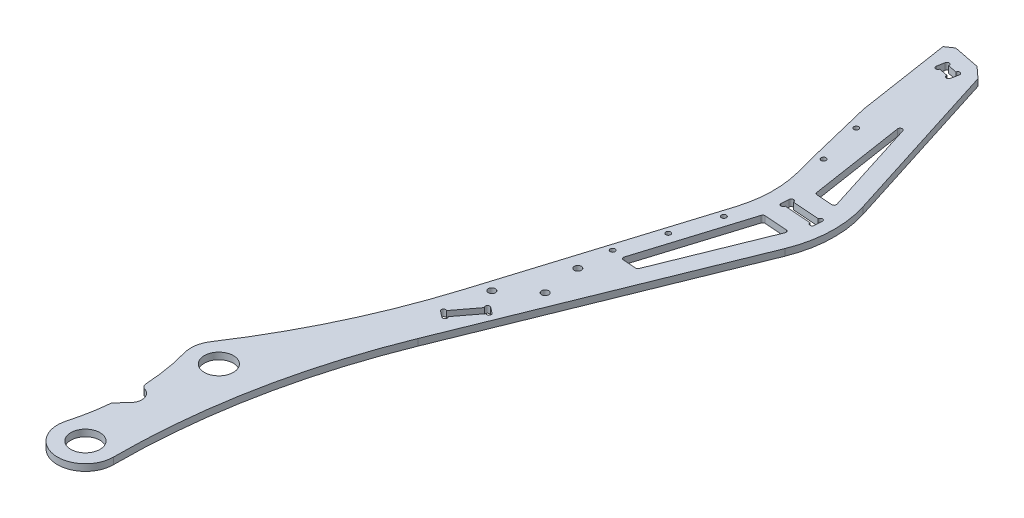
from build123d import *

# Parameters (mm, degrees)
SKETCH_3_R          = 12.55
SKETCH_3_R_2        = 6.55
EXTRUDE_1_DEPTH     = 3
CUT_EXTRUDE_3_DEPTH = 337.61902384
EXTRUDE_2_DEPTH     = 3
CHAMFER_1_SIZE      = 4
CHAMFER_1_SIZE2     = 3.120824035
CHAMFER_2_SIZE      = 4
CHAMFER_2_SIZE2     = 3.866160824
CHAMFER_3_SIZE      = 4
CHAMFER_3_SIZE2     = 23.911485469
SKETCH_8_R          = 1
CUT_EXTRUDE_4_DEPTH = 336.947679111
SKETCH_9_R          = 1.1
SKETCH_9_R_2        = 1.6
CUT_EXTRUDE_5_DEPTH = 336.947679111
FILLET_1_R          = 50
CUT_EXTRUDE_6_DEPTH = 335.374368924
FILLET_2_R          = 1
FILLET_3_R          = 1
EXTRUDE_3_DEPTH     = 3


with BuildPart() as part:
    # 草图3 → 凸台-拉伸1 (new body)
    # profile 1 of 4: a face of its own
    with BuildSketch(Plane(origin=(0, 0, 0), x_dir=(1, 0, 0), z_dir=(0, 1, 0))):
        with BuildLine():
            Line((121.265604443, 289.597455686), (128.868463655, 240.178870804))
            Line((128.868463655, 240.178870804), (141.647697325, 191.053787979))
            Line((141.647697325, 191.053787979), (108.429878461, 83.756455888))
            ThreePointArc((108.429878461, 83.756455888), (92.967297732, 44.045236663), (72.033938301, 6.925608458))
            ThreePointArc((72.033938301, 6.925608458), (86.116173784, 12.017728037), (95.05, 0))
            ThreePointArc((95.05, 0), (94.935972216, -1.687926254), (94.59596095, -3.34517992))
            ThreePointArc((94.59596095, -3.34517992), (96.273603044, 2.110037129), (98.259734457, 7.460659342))
            Line((98.259734457, 7.460659342), (171.571212245, 188.912934219))
            Line((171.571212245, 188.912934219), (140.881048659, 285.694335372))
            Line((140.881048659, 285.694335372), (121.265604443, 289.597455686))
        make_face()
    # profile 2 of 4: a face of its own
    with BuildSketch(Plane(origin=(0, 0, 0), x_dir=(1, 0, 0), z_dir=(0, 1, 0))):
        with Locations((82.5, 0)):
            Circle(SKETCH_3_R)
        with Locations(Location((82.5, 0, 0), (0, 0, 270))):
            Circle(SKETCH_3_R_2, mode=Mode.SUBTRACT)
    # profile 3 of 4: a face of its own
    with BuildSketch(Plane(origin=(0, 0, 0), x_dir=(1, 0, 0), z_dir=(0, 1, 0))):
        with BuildLine():
            ThreePointArc((94.59596095, -3.34517992), (82.5, -12.55), (70.40403905, -3.34517992))
            ThreePointArc((70.40403905, -3.34517992), (74.021880086, -30), (70.40403905, -56.65482008))
            ThreePointArc((70.40403905, -56.65482008), (82.5, -47.45), (94.59596095, -56.65482008))
            ThreePointArc((94.59596095, -56.65482008), (90.978119914, -30), (94.59596095, -3.34517992))
        make_face()
    # profile 4 of 4: a face of its own
    with BuildSketch(Plane(origin=(0, 0, 0), x_dir=(1, 0, 0), z_dir=(0, 1, 0))):
        with Locations((82.5, -60)):
            Circle(SKETCH_3_R)
        with Locations(Location((82.5, -60, 0), (0, 0, 270))):
            Circle(SKETCH_3_R_2, mode=Mode.SUBTRACT)
    extrude(amount=EXTRUDE_1_DEPTH)

    # 草图7 → 切除-拉伸3 (cut, through all)
    with BuildSketch(Plane(origin=(0, 3, 0), x_dir=(1, 0, 0), z_dir=(0, 1, 0))):
        with BuildLine():
            ThreePointArc((78.002512198, -34.493479197), (80.195428175, -33.349158141), (81.33105467, -31.151726999))
            ThreePointArc((81.33105467, -31.151726999), (81.29055467, -30.45576741), (81.33105467, -29.75980782))
            ThreePointArc((81.33105467, -29.75980782), (79.648864591, -27.101907795), (76.578597142, -26.418055622))
            ThreePointArc((76.578597142, -26.418055622), (74.734518785, -25.952185157), (73.857268025, -24.264556235))
            ThreePointArc((73.857268025, -24.264556235), (74.006073686, -31.777928612), (73.590239535, -39.281260509))
            Line((73.590239535, -39.281260509), (78.002512198, -34.493479197))
        make_face()
    extrude(amount=-CUT_EXTRUDE_3_DEPTH, mode=Mode.SUBTRACT)

    # 草图7<3> → 凸台-拉伸2 (add)
    with BuildSketch(Plane(origin=(0, 3, 0), x_dir=(1, 0, 0), z_dir=(0, 1, 0))):
        with BuildLine():
            ThreePointArc((91.066651947, -25.793033303), (90.979085958, -30.43955416), (91.10749612, -35.085125677))
            ThreePointArc((91.10749612, -35.085125677), (91.947297407, -34.239250868), (92.603316411, -33.24405769))
            ThreePointArc((92.603316411, -33.24405769), (93.116212163, -31.891634666), (93.29055467, -30.45576741))
            ThreePointArc((93.29055467, -30.45576741), (92.937299887, -28.427401453), (91.919131852, -26.637878821))
            ThreePointArc((91.919131852, -26.637878821), (91.514069696, -26.194086893), (91.066651947, -25.793033303))
        make_face()
        with BuildLine():
            ThreePointArc((92.603316411, -33.24405769), (91.947297407, -34.239250868), (91.10749612, -35.085125677))
            ThreePointArc((91.10749612, -35.085125677), (91.236559388, -37.184782804), (91.409760465, -39.281260509))
            ThreePointArc((91.409760465, -39.281260509), (91.568630527, -36.176084637), (92.603316411, -33.24405769))
        make_face()
        with BuildLine():
            ThreePointArc((91.142731975, -24.264556235), (91.101768, -25.028649229), (91.066651947, -25.793033303))
            ThreePointArc((91.066651947, -25.793033303), (91.514069696, -26.194086893), (91.919131852, -26.637878821))
            ThreePointArc((91.919131852, -26.637878821), (91.306680236, -25.524578384), (91.142731975, -24.264556235))
        make_face()
    extrude(amount=-EXTRUDE_2_DEPTH)

    # 倒角1
    chamfer_1_edges = [part.edges().sort_by_distance(p)[0] for p in [
        (121.265604443, 1.5, -289.597455686),
    ]]
    chamfer_1_side = [part.faces().sort_by_distance(p)[0] for p in [
        (131.073326551, 1.5, -287.645895529),
    ]]
    chamfer(chamfer_1_edges, length=CHAMFER_1_SIZE, length2=CHAMFER_1_SIZE2, reference=chamfer_1_side[0])

    # 倒角2
    chamfer_2_edges = [part.edges().sort_by_distance(p)[0] for p in [
        (140.881048659, 1.5, -285.694335372),
    ]]
    chamfer_2_side = [part.faces().sort_by_distance(p)[0] for p in [
        (156.226130452, 1.5, -237.303634796),
    ]]
    chamfer(chamfer_2_edges, length=CHAMFER_2_SIZE, length2=CHAMFER_2_SIZE2, reference=chamfer_2_side[0])

    # 倒角3
    chamfer_3_edges = [part.edges().sort_by_distance(p)[0] for p in [
        (128.868463655, 1.5, -240.178870804),
    ]]
    chamfer_3_side = [part.faces().sort_by_distance(p)[0] for p in [
        (125.304305907, 1.5, -263.34589617),
    ]]
    chamfer(chamfer_3_edges, length=CHAMFER_3_SIZE, length2=CHAMFER_3_SIZE2, reference=chamfer_3_side[0])

    # 草图8 → 切除-拉伸4 (cut, through all)
    with BuildSketch(Plane(origin=(0, 3, 0), x_dir=(1, 0, 0), z_dir=(0, 1, 0))):
        with Locations((129.481912621, 280.519443616)):
            Circle(SKETCH_8_R)
        with Locations((135.464623107, 279.32899192)):
            Circle(SKETCH_8_R)
        with Locations((128.818382167, 277.184818099)):
            Circle(SKETCH_8_R)
        with Locations((134.801092653, 275.994366404)):
            Circle(SKETCH_8_R)
        with Locations((147.653970306, 192.328419252)):
            Circle(SKETCH_8_R)
        with Locations((147.411340213, 188.937087561)):
            Circle(SKETCH_8_R)
        with Locations((161.718022318, 191.322217985)):
            Circle(SKETCH_8_R)
        with Locations((161.475392225, 187.930886294)):
            Circle(SKETCH_8_R)
        with Locations((112.339085524, 71.25713446)):
            Circle(SKETCH_8_R)
        with Locations((115.047221748, 69.201411183)):
            Circle(SKETCH_8_R)
        with Locations((120.86429088, 82.487934683)):
            Circle(SKETCH_8_R)
        with Locations((123.572427104, 80.432211406)):
            Circle(SKETCH_8_R)
        Polygon((128.50114041, 280.714599632), (136.445395318, 279.133835905), (135.781864864, 275.799210388), (127.837609957, 277.379974115), align=None)
        Polygon((146.656519808, 192.399781044), (162.715472815, 191.250856193), (162.472842723, 187.859524502), (146.413889715, 189.008449353), align=None)
        Polygon((111.734461031, 70.460623806), (121.468915373, 83.284445337), (124.177051597, 81.22872206), (114.442597255, 68.404900529), align=None)
    extrude(amount=-CUT_EXTRUDE_4_DEPTH, mode=Mode.SUBTRACT)

    # 草图9 → 切除-拉伸5 (cut, through all)
    with BuildSketch(Plane(origin=(0, 3, 0), x_dir=(1, 0, 0), z_dir=(0, 1, 0))):
        with Locations(Location((133.980578042, 235.236844896, 0), (0, 0, 270))):
            Circle(SKETCH_9_R)
        with Locations(Location((138.710717702, 215.804249115, 0), (0, 0, 270))):
            Circle(SKETCH_9_R)
        with Locations(Location((138.598734412, 171.061193721, 0), (0, 0, 270))):
            Circle(SKETCH_9_R)
        with Locations(Location((132.68396468, 151.955814923, 0), (0, 0, 270))):
            Circle(SKETCH_9_R)
        with Locations(Location((126.769194947, 132.850436126, 0), (0, 0, 270))):
            Circle(SKETCH_9_R)
        with Locations(Location((125.973199927, 118, 0), (0, 0, 270))):
            Circle(SKETCH_9_R_2)
        with Locations(Location((115.368060475, 89.937016958, 0), (0, 0, 270))):
            Circle(SKETCH_9_R_2)
        with Locations(Location((128.154092345, 101.140471292, 0), (0, 0, 270))):
            Circle(SKETCH_9_R_2)
    extrude(amount=-CUT_EXTRUDE_5_DEPTH, mode=Mode.SUBTRACT)

    # 圆角1
    fillet_1_edges = [part.edges().sort_by_distance(p)[0] for p in [
        (141.647697325, 1.5, -191.053787979),
        (171.571212245, 1.5, -188.912934219),
    ]]
    fillet(fillet_1_edges, radius=FILLET_1_R)

    # 草图11 → 切除-拉伸6 (cut, through all)
    with BuildSketch(Plane(origin=(0, 3, 0), x_dir=(1, 0, 0), z_dir=(0, 1, 0))):
        Polygon((141.594357666, 256.978870067), (150.289401614, 200.461084402), (159.730803103, 199.785606942), align=None)
        Polygon((146.804308515, 180.659302195), (159.248540878, 179.768989619), (139.564574089, 131.049462198), (131.621693467, 131.617729191), align=None)
    extrude(amount=-CUT_EXTRUDE_6_DEPTH, mode=Mode.SUBTRACT)

    # 圆角2
    fillet_2_edges = [part.edges().sort_by_distance(p)[0] for p in [
        (159.730803103, 1.5, -199.785606942),
        (150.289401614, 1.5, -200.461084402),
        (131.621693467, 1.5, -131.617729191),
        (146.804308515, 1.5, -180.659302195),
        (159.248540878, 1.5, -179.768989619),
        (139.564574089, 1.5, -131.049462198),
        (73.590239535, 1.5, 39.281260509),
        (78.002512198, 1.5, 34.493479197),
    ]]
    fillet(fillet_2_edges, radius=FILLET_2_R)

    # 圆角3
    fillet_3_edges = [part.edges().sort_by_distance(p)[0] for p in [
        (141.594357666, 1.5, -256.978870067),
    ]]
    fillet(fillet_3_edges, radius=FILLET_3_R)

    # 草图12 → 凸台-拉伸3 (add)
    with BuildSketch(Plane(origin=(0, 3, 0), x_dir=(1, 0, 0), z_dir=(0, 1, 0))):
        with BuildLine():
            Line((98.259734457, 7.460659342), (117.34519382, 54.698828901))
            ThreePointArc((117.34519382, 54.698828901), (100.675476378, -1.577194053), (95.05, -60))
            ThreePointArc((95.05, -60), (94.935972216, -58.312073746), (94.59596095, -56.65482008))
            ThreePointArc((94.59596095, -56.65482008), (92.618516623, -48.038526559), (91.409760465, -39.281260509))
            ThreePointArc((91.409760465, -39.281260509), (91.568630527, -36.176084637), (92.603316411, -33.24405769))
            ThreePointArc((92.603316411, -33.24405769), (93.258632644, -29.837669281), (91.919131852, -26.637878821))
            ThreePointArc((91.919131852, -26.637878821), (91.306680236, -25.524578384), (91.142731975, -24.264556235))
            ThreePointArc((91.142731975, -24.264556235), (93.403219258, -8.110761503), (98.259734457, 7.460659342))
        make_face()
        with BuildLine():
            ThreePointArc((81.33105467, -29.75980782), (79.648864591, -27.101907795), (76.578597142, -26.418055622))
            ThreePointArc((76.578597142, -26.418055622), (76.037227153, -26.449216759), (75.503392909, -26.353961938))
            ThreePointArc((75.503392909, -26.353961938), (78.962149718, -29.908542384), (77.787287008, -34.727021234))
            ThreePointArc((77.787287008, -34.727021234), (78.012719423, -34.54448268), (78.281056834, -34.43432311))
            ThreePointArc((78.281056834, -34.43432311), (80.294153345, -33.246537017), (81.33105467, -31.151726999))
            ThreePointArc((81.33105467, -31.151726999), (81.29055467, -30.45576741), (81.33105467, -29.75980782))
        make_face()
    extrude(amount=-EXTRUDE_3_DEPTH)


solid = part.part
